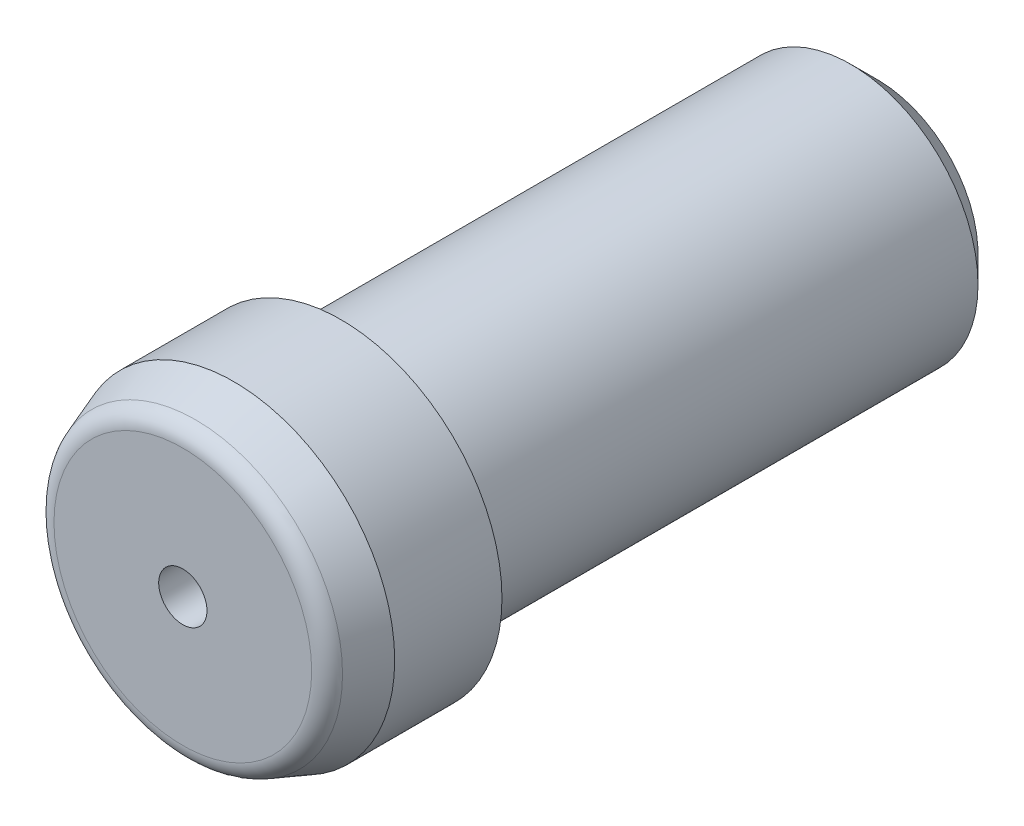
from build123d import *

# Parameters (mm, degrees)
CHAMFER1_SIZE      = 1.27
FILLET1_R          = 0.9144
SKETCH3_R          = 1.143
CUT_EXTRUDE1_DEPTH = 2.54
CUT_EXTRUDE2_START = -2.54
SKETCH4_R          = 1.143
CUT_EXTRUDE2_DEPTH = 2.54


with BuildPart() as part:
    # Sketch1 → Revolve1 (revolve)
    with BuildSketch(Plane(origin=(0, 0, 0), x_dir=(0, 0, -1), z_dir=(1, 0, 0)), mode=Mode.PRIVATE) as revolve1_sk:
        Polygon((0, 0), (0, 6.741739825), (2.413, 7.62), (7.493, 7.62), (7.493, 6.0325), (32.893, 6.0325), (32.893, 0), align=None)
    revolve(revolve1_sk.sketch.rotate(Axis((0, 0, -133.35), (0, 0, 1)), 90), axis=Axis((0, 0, -133.35), (0, 0, 1)))

    # Sketch2 → Cut-Revolve1 (revolve, cut)
    with BuildSketch(Plane(origin=(0, 0, 0), x_dir=(0, 0, -1), z_dir=(1, 0, 0)), mode=Mode.PRIVATE) as cut_revolve1_sk:
        with BuildLine():
            Line((7.294796158, 6.342296158), (7.747, 6.7945))
            Line((7.747, 6.7945), (8.255, 6.7945))
            Line((8.255, 6.7945), (8.255, 6.2865))
            Line((8.255, 6.2865), (7.802796158, 5.834296158))
            ThreePointArc((7.802796158, 5.834296158), (7.74099351, 5.793000949), (7.668092316, 5.7785))
            Line((7.668092316, 5.7785), (7.4295, 5.7785))
            ThreePointArc((7.4295, 5.7785), (7.294796158, 5.834296158), (7.239, 5.969))
            Line((7.239, 5.969), (7.239, 6.207592316))
            ThreePointArc((7.239, 6.207592316), (7.253500949, 6.28049351), (7.294796158, 6.342296158))
        make_face()
    revolve(cut_revolve1_sk.sketch.rotate(Axis((0, 0, -133.35), (0, 0, 1)), 90), axis=Axis((0, 0, -133.35), (0, 0, 1)), mode=Mode.SUBTRACT)

    # Chamfer1
    chamfer1_edges = [part.edges().sort_by_distance(p)[0] for p in [
        (6.0325, 0, -32.893),
    ]]
    chamfer(chamfer1_edges, length=CHAMFER1_SIZE)

    # Fillet1
    fillet1_edges = [part.edges().sort_by_distance(p)[0] for p in [
        (6.741739825, 0, 0),
    ]]
    fillet(fillet1_edges, radius=FILLET1_R)

    # Sketch3 → Cut-Extrude1 (cut)
    with BuildSketch(Plane.XY):
        Circle(SKETCH3_R)
    extrude(amount=-CUT_EXTRUDE1_DEPTH, mode=Mode.SUBTRACT)

    # Sketch4 → Cut-Extrude2 (cut)
    with BuildSketch(Plane(origin=(0, 0, -32.893), x_dir=(-1, 0, 0), z_dir=(0, 0, -1)).offset(CUT_EXTRUDE2_START)):
        with Locations(Location((0, 0, 0), (0, 0, 180))):
            Circle(SKETCH4_R)
    extrude(amount=CUT_EXTRUDE2_DEPTH, mode=Mode.SUBTRACT)


solid = part.part
